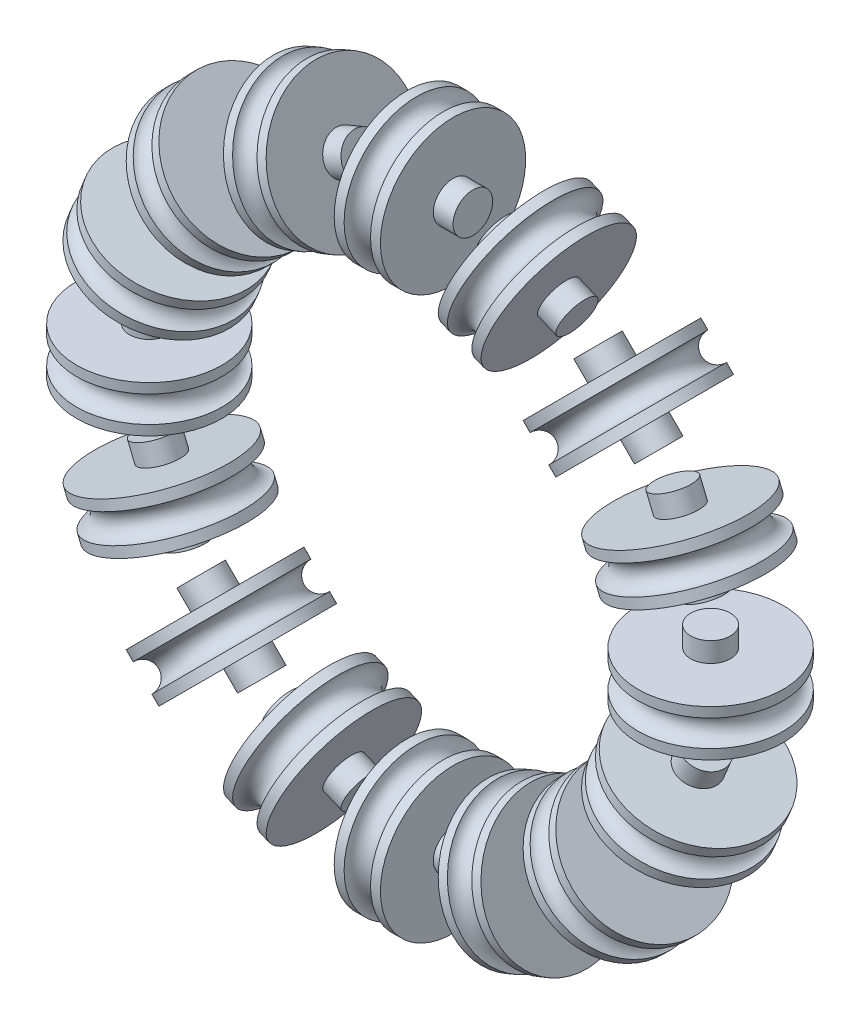
from build123d import *

# Parameters (mm, degrees)
CIRPATTERN1_COUNT = 16


with BuildPart() as part:
    # Esboço1 → Revolução1 (revolve)
    with BuildSketch(Plane.XY):
        with BuildLine():
            Line((-1.750145627, 21.25), (1.75, 21.25))
            Line((1.75, 21.25), (3.25, 21.25))
            Line((3.25, 21.25), (3.25, 19.75))
            Line((3.25, 19.75), (1.75, 19.75))
            Line((1.75, 19.75), (1.75, 15.75))
            Line((1.75, 15.75), (1, 15.75))
            ThreePointArc((1, 15.75), (0, 16.75), (-1, 15.75))
            Line((-1, 15.75), (-1.75, 15.75))
            Line((-1.75, 15.75), (-1.75, 19.75))
            Line((-1.75, 19.75), (-3.25, 19.75))
            Line((-3.25, 19.75), (-3.25, 21.25))
            Line((-3.25, 21.25), (-1.750145627, 21.25))
        make_face()
    revolve(axis=Axis((-1.750145627, 21.25, 0), (1, 0, 0)))


with BuildPart() as cirpattern1_1:
    # CirPattern1: pattern copy
    add(part.part.rotate(Axis((0, 0, 27.464734488), (0, 0, -1)), 1 * 360 / CIRPATTERN1_COUNT))


with BuildPart() as cirpattern1_2:
    # CirPattern1: pattern copy
    add(part.part.rotate(Axis((0, 0, 27.464734488), (0, 0, -1)), 2 * 360 / CIRPATTERN1_COUNT))


with BuildPart() as cirpattern1_3:
    # CirPattern1: pattern copy
    add(part.part.rotate(Axis((0, 0, 27.464734488), (0, 0, -1)), 3 * 360 / CIRPATTERN1_COUNT))


with BuildPart() as cirpattern1_4:
    # CirPattern1: pattern copy
    add(part.part.rotate(Axis((0, 0, 27.464734488), (0, 0, -1)), 4 * 360 / CIRPATTERN1_COUNT))


with BuildPart() as cirpattern1_5:
    # CirPattern1: pattern copy
    add(part.part.rotate(Axis((0, 0, 27.464734488), (0, 0, -1)), 5 * 360 / CIRPATTERN1_COUNT))


with BuildPart() as cirpattern1_6:
    # CirPattern1: pattern copy
    add(part.part.rotate(Axis((0, 0, 27.464734488), (0, 0, -1)), 6 * 360 / CIRPATTERN1_COUNT))


with BuildPart() as cirpattern1_7:
    # CirPattern1: pattern copy
    add(part.part.rotate(Axis((0, 0, 27.464734488), (0, 0, -1)), 7 * 360 / CIRPATTERN1_COUNT))


with BuildPart() as cirpattern1_8:
    # CirPattern1: pattern copy
    add(part.part.rotate(Axis((0, 0, 27.464734488), (0, 0, -1)), 8 * 360 / CIRPATTERN1_COUNT))


with BuildPart() as cirpattern1_9:
    # CirPattern1: pattern copy
    add(part.part.rotate(Axis((0, 0, 27.464734488), (0, 0, -1)), 9 * 360 / CIRPATTERN1_COUNT))


with BuildPart() as cirpattern1_10:
    # CirPattern1: pattern copy
    add(part.part.rotate(Axis((0, 0, 27.464734488), (0, 0, -1)), 10 * 360 / CIRPATTERN1_COUNT))


with BuildPart() as cirpattern1_11:
    # CirPattern1: pattern copy
    add(part.part.rotate(Axis((0, 0, 27.464734488), (0, 0, -1)), 11 * 360 / CIRPATTERN1_COUNT))


with BuildPart() as cirpattern1_12:
    # CirPattern1: pattern copy
    add(part.part.rotate(Axis((0, 0, 27.464734488), (0, 0, -1)), 12 * 360 / CIRPATTERN1_COUNT))


with BuildPart() as cirpattern1_13:
    # CirPattern1: pattern copy
    add(part.part.rotate(Axis((0, 0, 27.464734488), (0, 0, -1)), 13 * 360 / CIRPATTERN1_COUNT))


with BuildPart() as cirpattern1_14:
    # CirPattern1: pattern copy
    add(part.part.rotate(Axis((0, 0, 27.464734488), (0, 0, -1)), 14 * 360 / CIRPATTERN1_COUNT))


with BuildPart() as cirpattern1_15:
    # CirPattern1: pattern copy
    add(part.part.rotate(Axis((0, 0, 27.464734488), (0, 0, -1)), 15 * 360 / CIRPATTERN1_COUNT))


solid = Compound([part.part, cirpattern1_1.part, cirpattern1_2.part, cirpattern1_3.part, cirpattern1_4.part, cirpattern1_5.part, cirpattern1_6.part, cirpattern1_7.part, cirpattern1_8.part, cirpattern1_9.part, cirpattern1_10.part, cirpattern1_11.part, cirpattern1_12.part, cirpattern1_13.part, cirpattern1_14.part, cirpattern1_15.part])
